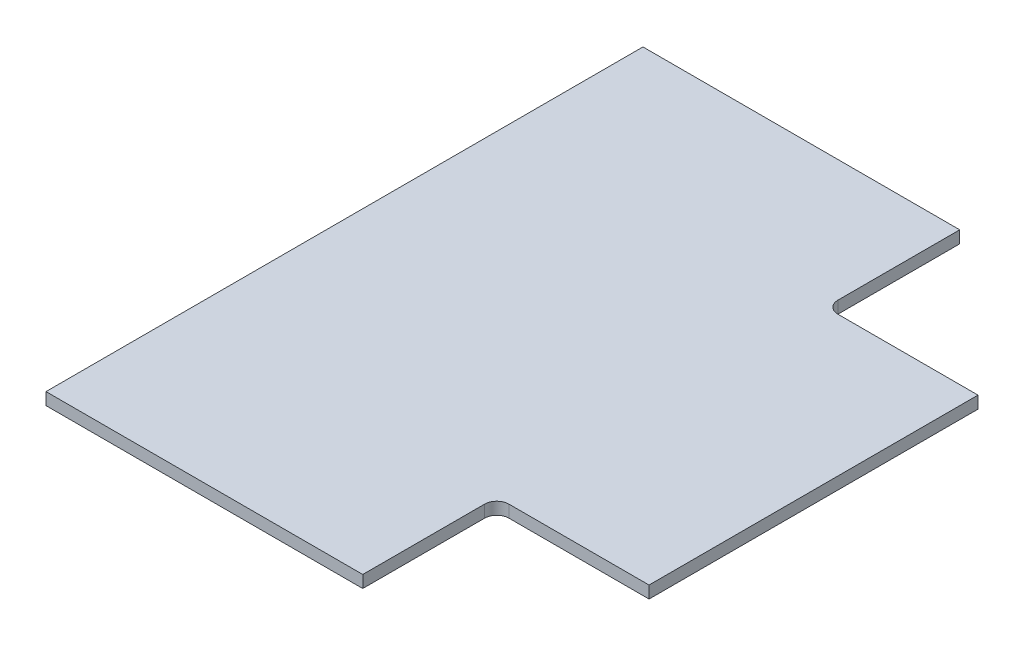
from build123d import *

# Parameters (mm, degrees)
SALIENTE_EXTRUIR1_DEPTH = 2


with BuildPart() as part:
    # Croquis1 → Saliente-Extruir1 (new body)
    with BuildSketch(Plane(origin=(0, 0, 0), x_dir=(1, 0, 0), z_dir=(0, 1, 0))):
        with BuildLine():
            Line((0, -49), (0, 49))
            Line((0, 49), (52, 49))
            Line((52, 49), (52, 29))
            ThreePointArc((52, 29), (52.585786438, 27.585786438), (54, 27))
            Line((54, 27), (77, 27))
            Line((77, 27), (77, -27))
            Line((77, -27), (54, -27))
            ThreePointArc((54, -27), (52.585786438, -27.585786438), (52, -29))
            Line((52, -29), (52, -49))
            Line((52, -49), (0, -49))
        make_face()
    extrude(amount=SALIENTE_EXTRUIR1_DEPTH)


solid = part.part
